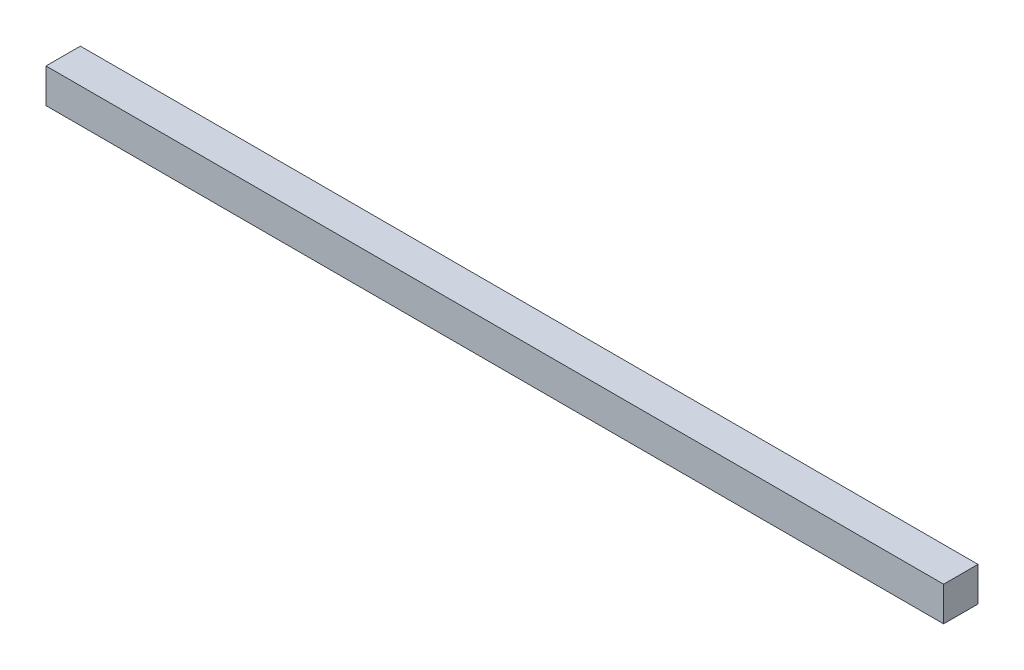
from build123d import *

# Parameters (mm, degrees)
BOSS_EXTRUDE1_DEPTH      = 117.5
BOSS_EXTRUDE1_DEPTH_BACK = 117.5
SKETCH2_W                = 9
SKETCH2_H                = 9


with BuildPart() as part:
    # Sketch2 → Boss-Extrude1 (new, two sides: drawn at the far end of the back side and taken through both)
    with BuildSketch(Plane(origin=(0, 0, 0), x_dir=(0, 0, -1), z_dir=(1, 0, 0)).offset(-BOSS_EXTRUDE1_DEPTH_BACK)):
        Rectangle(SKETCH2_W, SKETCH2_H)
    extrude(amount=BOSS_EXTRUDE1_DEPTH + BOSS_EXTRUDE1_DEPTH_BACK)


solid = part.part
